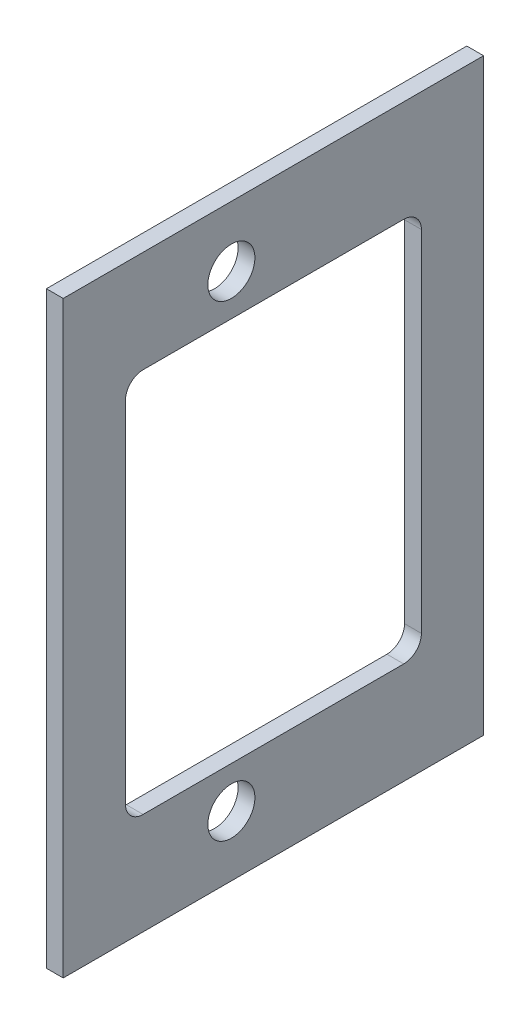
from build123d import *

# Parameters (mm, degrees)
SKETCH1_W           = 25
SKETCH1_H           = 35
BOSS_EXTRUDE1_DEPTH = 1
SKETCH2_R           = 1.4
CUT_EXTRUDE1_DEPTH  = 1


with BuildPart() as part:
    # Sketch1 → Boss-Extrude1 (new body)
    with BuildSketch(Plane(origin=(0, 0, 0), x_dir=(0, 0, -1), z_dir=(1, 0, 0))):
        Rectangle(SKETCH1_W, SKETCH1_H)
    extrude(amount=BOSS_EXTRUDE1_DEPTH)

    # Sketch2 → Cut-Extrude1 (cut)
    with BuildSketch(Plane.ZY):
        with Locations((2.5, 13.9)):
            Circle(SKETCH2_R)
        with Locations((2.5, -13.9)):
            Circle(SKETCH2_R)
        with BuildLine():
            Line((-8.8, 10.4), (-8.8, -10.4))
            ThreePointArc((-8.8, -10.4), (-8.49246212, -11.14246212), (-7.75, -11.45))
            Line((-7.75, -11.45), (7.75, -11.45))
            ThreePointArc((7.75, -11.45), (8.49246212, -11.14246212), (8.8, -10.4))
            Line((8.8, -10.4), (8.8, 10.4))
            ThreePointArc((8.8, 10.4), (8.49246212, 11.14246212), (7.75, 11.45))
            Line((7.75, 11.45), (-7.75, 11.45))
            ThreePointArc((-7.75, 11.45), (-8.49246212, 11.14246212), (-8.8, 10.4))
        make_face()
    extrude(amount=-CUT_EXTRUDE1_DEPTH, mode=Mode.SUBTRACT)


solid = part.part
